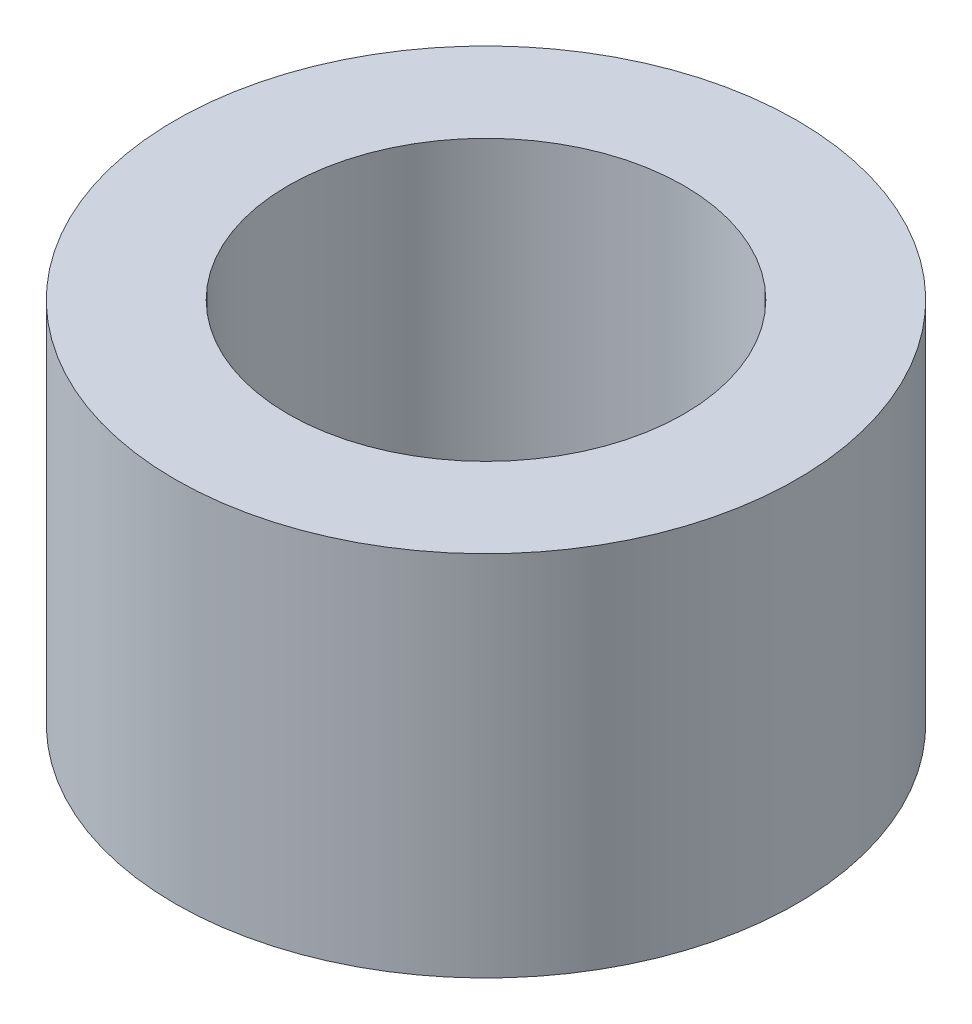
from build123d import *

# Parameters (mm, degrees)
CROQUIS1_R              = 11
CROQUIS1_R_2            = 7
SALIENTE_EXTRUIR1_DEPTH = 13


with BuildPart() as part:
    # Croquis1 → Saliente-Extruir1 (new body)
    with BuildSketch(Plane(origin=(0, 0, 0), x_dir=(1, 0, 0), z_dir=(0, 1, 0))):
        with Locations(Location((0, 0, 0), (0, 0, 90))):
            Circle(CROQUIS1_R)
        with Locations(Location((0, 0, 0), (0, 0, 90))):
            Circle(CROQUIS1_R_2, mode=Mode.SUBTRACT)
    extrude(amount=SALIENTE_EXTRUIR1_DEPTH)


solid = part.part
